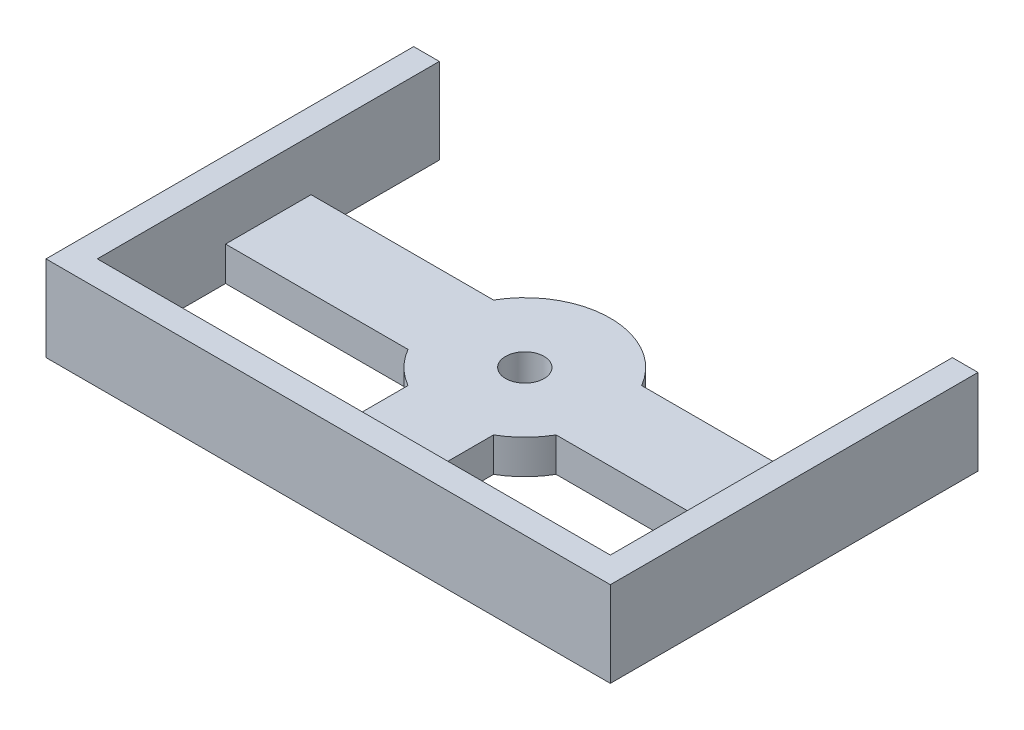
from build123d import *

# Parameters (mm, degrees)
BOSS_EXTRUDE1_DEPTH = 10
SKETCH2_R           = 2.25
BOSS_EXTRUDE2_DEPTH = 4


with BuildPart() as part:
    # Sketch1 → Boss-Extrude1 (new body)
    with BuildSketch(Plane(origin=(0, 0, 0), x_dir=(1, 0, 0), z_dir=(0, 1, 0))):
        Polygon((0, -40), (0, 0), (-3, 0), (-3, -43), (63, -43), (63, 0), (60, 0), (60, -40), align=None)
    extrude(amount=BOSS_EXTRUDE1_DEPTH)

    # Sketch2 → Boss-Extrude2 (add)
    with BuildSketch(Plane(origin=(0, 0, 0), x_dir=(1, 0, 0), z_dir=(0, 1, 0))):
        with BuildLine():
            Line((0, -15), (0, -25))
            Line((0, -25), (21.339745962, -25))
            ThreePointArc((21.339745962, -25), (22.928932188, -27.071067812), (25, -28.660254038))
            Line((25, -28.660254038), (25, -40))
            Line((25, -40), (35, -40))
            Line((35, -40), (35, -28.660254038))
            ThreePointArc((35, -28.660254038), (37.071067812, -27.071067812), (38.660254038, -25))
            Line((38.660254038, -25), (60, -25))
            Line((60, -25), (60, -15))
            Line((60, -15), (38.660254038, -15))
            ThreePointArc((38.660254038, -15), (30, -10), (21.339745962, -15))
            Line((21.339745962, -15), (0, -15))
        make_face()
        with Locations(Location((30, -20, 0), (0, 0, 270))):
            Circle(SKETCH2_R, mode=Mode.SUBTRACT)
    extrude(amount=BOSS_EXTRUDE2_DEPTH)


solid = part.part
